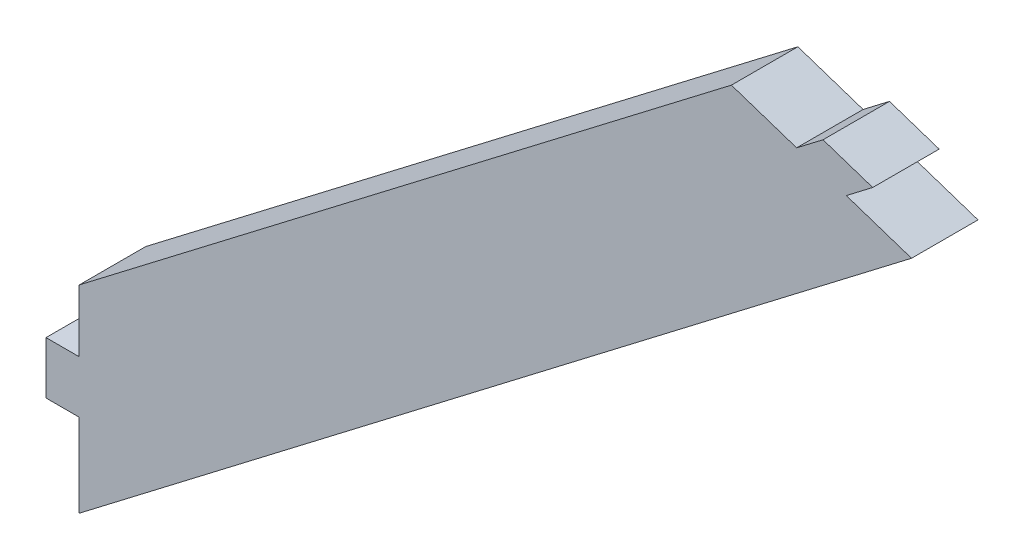
from build123d import *

# Parameters (mm, degrees)
BOSS_EXTRUDE1_DEPTH = 6.35


with BuildPart() as part:
    # Sketch1 → Boss-Extrude1 (new body)
    with BuildSketch(Plane.XY):
        Polygon((-29.201226365, -67.033313465), (50.302826563, -6.188945238), (44.07202244, -4.117352604), (46.593386833, -2.187755082), (41.84875139, -0.610277819), (39.327386997, -2.539875342), (33.096582874, -0.468282708), (1.434591331, -24.69917159), (-29.201226365, -48.144730706), (-29.201226365, -54.089022086), (-32.376226365, -54.089022086), (-32.376226365, -59.089022086), (-29.201226365, -59.089022086), align=None)
    extrude(amount=BOSS_EXTRUDE1_DEPTH)


solid = part.part
